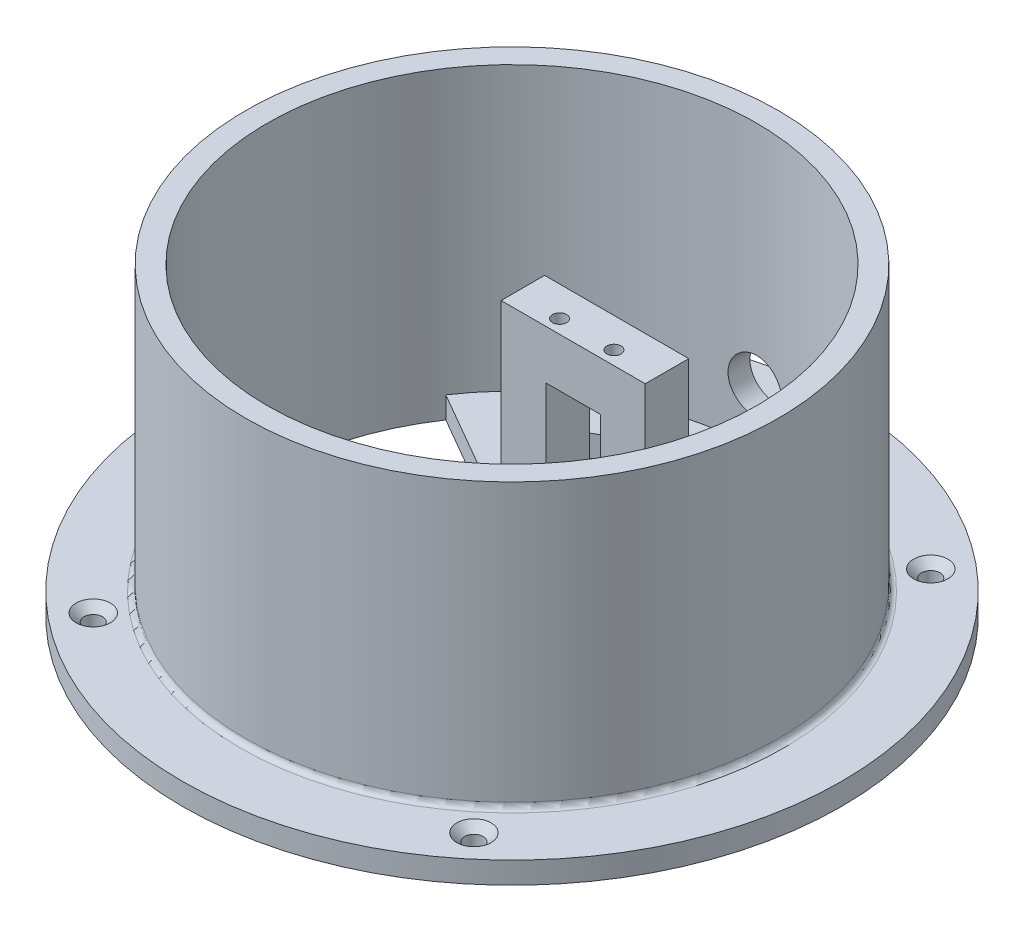
from build123d import *

# Parameters (mm, degrees)
SKETCH1_R                                           = 60.625
SKETCH1_R_2                                         = 45
BOSS_EXTRUDE1_DEPTH                                 = 4
SKETCH2_R                                           = 49
SKETCH2_R_2                                         = 45
BOSS_EXTRUDE2_DEPTH                                 = 52
SKETCH3_W                                           = 8
SKETCH3_H                                           = 38
BOSS_EXTRUDE3_DEPTH                                 = 13.25
SKETCH6_W                                           = 10
SKETCH6_H                                           = 24
CUT_EXTRUDE1_DEPTH                                  = 26
SKETCH7_R                                           = 5
CUT_EXTRUDE2_DEPTH                                  = 58
SKETCH8_R                                           = 1.3
CUT_EXTRUDE3_DEPTH                                  = 7.2
BOSS_EXTRUDE4_DEPTH                                 = 4
CSK_FOR_M3_COUNTERSUNK_FLAT_HEAD_SCREW1_D           = 3.4
CSK_FOR_M3_COUNTERSUNK_FLAT_HEAD_SCREW1_DEPTH       = 4
CSK_FOR_M3_COUNTERSUNK_FLAT_HEAD_SCREW1_CSINK_D     = 6.3
CSK_FOR_M3_COUNTERSUNK_FLAT_HEAD_SCREW1_CSINK_ANGLE = 90
CSK_FOR_M3_COUNTERSUNK_FLAT_HEAD_SCREW1_TIP         = 1.021463052
FILLET1_R                                           = 1


with BuildPart() as part:
    # Sketch1 → Boss-Extrude1 (new body)
    with BuildSketch(Plane(origin=(0, 0, 0), x_dir=(1, 0, 0), z_dir=(0, 1, 0))):
        with Locations(Location((0, 0, 0), (0, 0, 270))):
            Circle(SKETCH1_R)
        with Locations(Location((0, 0, 0), (0, 0, 270))):
            Circle(SKETCH1_R_2, mode=Mode.SUBTRACT)
    extrude(amount=BOSS_EXTRUDE1_DEPTH)

    # Sketch2 → Boss-Extrude2 (add)
    with BuildSketch(Plane(origin=(0, 4, 0), x_dir=(1, 0, 0), z_dir=(0, 1, 0))):
        with Locations(Location((0, 0, 0), (0, 0, 90))):
            Circle(SKETCH2_R)
        with Locations(Location((0, 0, 0), (0, 0, 270))):
            Circle(SKETCH2_R_2, mode=Mode.SUBTRACT)
    extrude(amount=BOSS_EXTRUDE2_DEPTH)

    # Sketch3 → Boss-Extrude3 (add, symmetric)
    with BuildSketch(Plane(origin=(0, 0, 0), x_dir=(0, 0, -1), z_dir=(1, 0, 0))):
        with Locations((15.25, 19)):
            Rectangle(SKETCH3_W, SKETCH3_H)
        Polygon((-45, 38), (-45, 30), (-39.75, 30), (-31.75, 38), align=None)
        Polygon((-39.75, 30), (-45, 30), (-45, 24.75), align=None)
        Polygon((-31.75, 38), (-39.75, 30), (-31.75, 30), align=None)
    extrude(amount=BOSS_EXTRUDE3_DEPTH, both=True)


with BuildPart() as boss_extrude3_piece_1:
    # of the separate pieces the step leaves, piece 1, a body of its own (boss_extrude3_pieces)
    add(part.part.solids().sort_by_distance((0, 0, 60.625))[0])

    # Sketch7 → Cut-Extrude2 (cut)
    with BuildSketch(Plane.XY.offset(-11.25)):
        with Locations(Location((0, 14, 0), (0, 0, 90))):
            Circle(SKETCH7_R)
    extrude(amount=-CUT_EXTRUDE2_DEPTH, mode=Mode.SUBTRACT)


with BuildPart() as boss_extrude3_piece_2:
    # of the separate pieces the step leaves, piece 2, a body of its own (boss_extrude3_pieces)
    add(part.part.solids().sort_by_distance((-13.25, 38, -19.25))[0])

    # Sketch6 → Cut-Extrude1 (cut)
    with BuildSketch(Plane.XY.offset(-11.25)):
        with Locations((0, 17)):
            Rectangle(SKETCH6_W, SKETCH6_H)
    extrude(amount=-CUT_EXTRUDE1_DEPTH, mode=Mode.SUBTRACT)


with BuildPart() as cut_extrude3_tool:
    # Sketch8 → Cut-Extrude3 (new body)
    with BuildSketch(Plane(origin=(0, 38, 0), x_dir=(1, 0, 0), z_dir=(0, 1, 0))):
        with Locations(Location((-5, 13.75, 0), (0, 0, 270))):
            Circle(SKETCH8_R)
        with Locations(Location((5, 13.75, 0), (0, 0, 270))):
            Circle(SKETCH8_R)
        with Locations(Location((-5, -34.25, 0), (0, 0, 270))):
            Circle(SKETCH8_R)
        with Locations(Location((5, -34.25, 0), (0, 0, 270))):
            Circle(SKETCH8_R)
    extrude(amount=-CUT_EXTRUDE3_DEPTH)


with BuildPart() as boss_extrude3_piece_1_1:
    add(boss_extrude3_piece_1.part)

    # Cut-Extrude3: cut by cut_extrude3_tool
    add(cut_extrude3_tool.part, mode=Mode.SUBTRACT)



with BuildPart() as boss_extrude3_piece_2_1:
    add(boss_extrude3_piece_2.part)

    # Cut-Extrude3: cut by cut_extrude3_tool
    add(cut_extrude3_tool.part, mode=Mode.SUBTRACT)


with BuildPart() as boss_extrude3_piece_1_2:
    add(boss_extrude3_piece_1_1.part)

    add(boss_extrude3_piece_2_1.part)  # Boss-Extrude4 merges Boss-Extrude3 piece 2
    # Sketch9 → Boss-Extrude4 (add)
    with BuildSketch(Plane.XZ):
        with BuildLine():
            Line((13.25, -11.25), (-13.25, -11.25))
            Line((-13.25, -11.25), (-37.318601349, -25.146013468))
            ThreePointArc((-37.318601349, -25.146013468), (0, -45), (37.318601349, -25.146013468))
            Line((37.318601349, -25.146013468), (13.25, -11.25))
        make_face()
        with BuildLine():
            Line((-19.766660498, -24.25), (-25.003275373, -27.273361007))
            ThreePointArc((-25.003275373, -27.273361007), (0, -37), (25.003275373, -27.273361007))
            Line((25.003275373, -27.273361007), (19.766660498, -24.25))
            Line((19.766660498, -24.25), (-19.766660498, -24.25))
        make_face(mode=Mode.SUBTRACT)
    extrude(amount=-BOSS_EXTRUDE4_DEPTH)

    # CSK for M3 Countersunk Flat Head Screw1
    with Locations(Plane(origin=(0, 4, 0), x_dir=(1, 0, 0), z_dir=(0, 1, 0))):
        with Locations((-35, 42), (35, 42), (35, -42), (-35, -42)):
            CounterSinkHole(CSK_FOR_M3_COUNTERSUNK_FLAT_HEAD_SCREW1_D / 2, CSK_FOR_M3_COUNTERSUNK_FLAT_HEAD_SCREW1_CSINK_D / 2, depth=CSK_FOR_M3_COUNTERSUNK_FLAT_HEAD_SCREW1_DEPTH, counter_sink_angle=CSK_FOR_M3_COUNTERSUNK_FLAT_HEAD_SCREW1_CSINK_ANGLE)
            with Locations((0, 0, -(CSK_FOR_M3_COUNTERSUNK_FLAT_HEAD_SCREW1_DEPTH + CSK_FOR_M3_COUNTERSUNK_FLAT_HEAD_SCREW1_TIP / 2))):  # 118° drill point
                Cone(0, CSK_FOR_M3_COUNTERSUNK_FLAT_HEAD_SCREW1_D / 2, CSK_FOR_M3_COUNTERSUNK_FLAT_HEAD_SCREW1_TIP, mode=Mode.SUBTRACT)

    # Fillet1
    fillet1_edges = [boss_extrude3_piece_1_2.edges().sort_by_distance(p)[0] for p in [
        (0, 4, 49),
    ]]
    fillet(fillet1_edges, radius=FILLET1_R)


solid = boss_extrude3_piece_1_2.part
